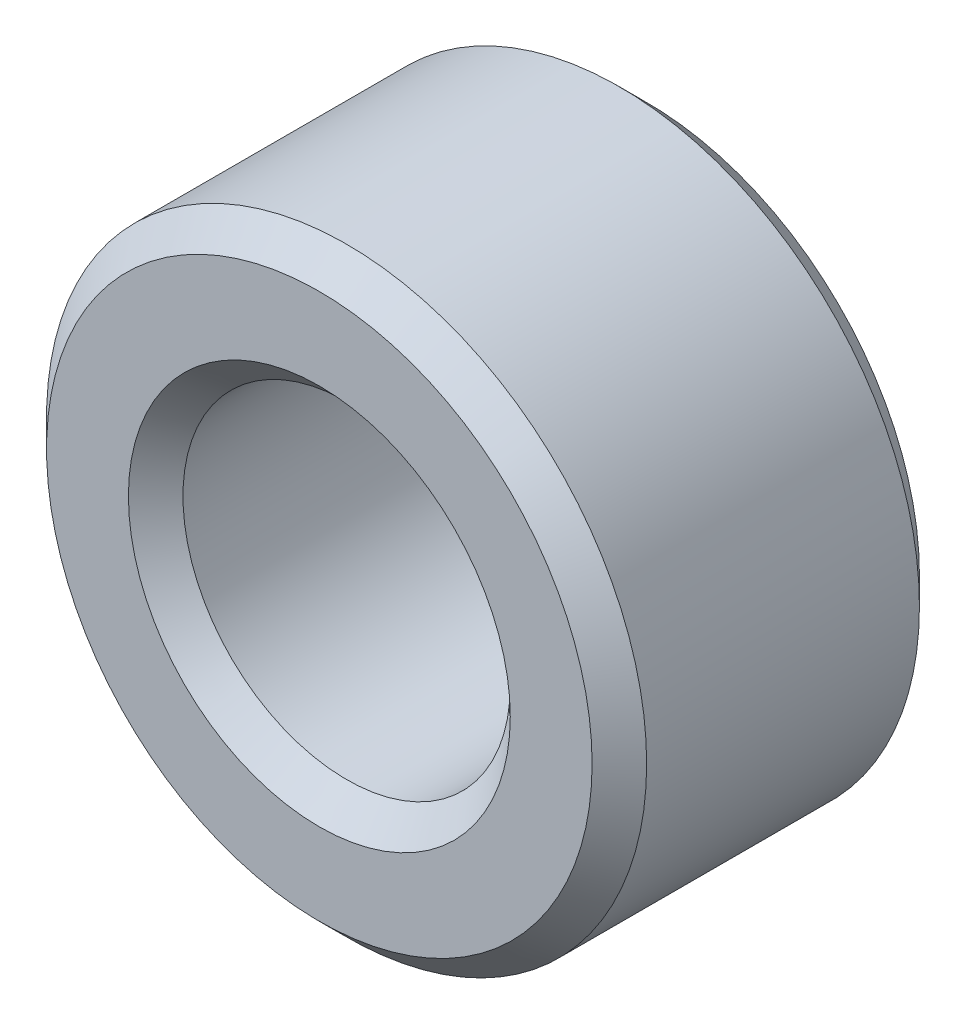
from build123d import *

# Parameters (mm, degrees)
SKICA1_R                = 5.5
SKICA1_R_2              = 3
P_IDAT_VYSUNUT_M1_DEPTH = 6
ZKOSEN_1_SIZE           = 0.5


with BuildPart() as part:
    # Skica1 → Přidat vysunutím1 (new body)
    with BuildSketch(Plane.XY):
        Circle(SKICA1_R)
        Circle(SKICA1_R_2, mode=Mode.SUBTRACT)
    extrude(amount=P_IDAT_VYSUNUT_M1_DEPTH)

    # Zkosení1
    zkosen_1_edges = [part.edges().sort_by_distance(p)[0] for p in [
        (-5.5, 0, 0),
        (-5.5, 0, 6),
        (-3, 0, 0),
        (-3, 0, 6),
    ]]
    chamfer(zkosen_1_edges, length=ZKOSEN_1_SIZE)


solid = part.part
